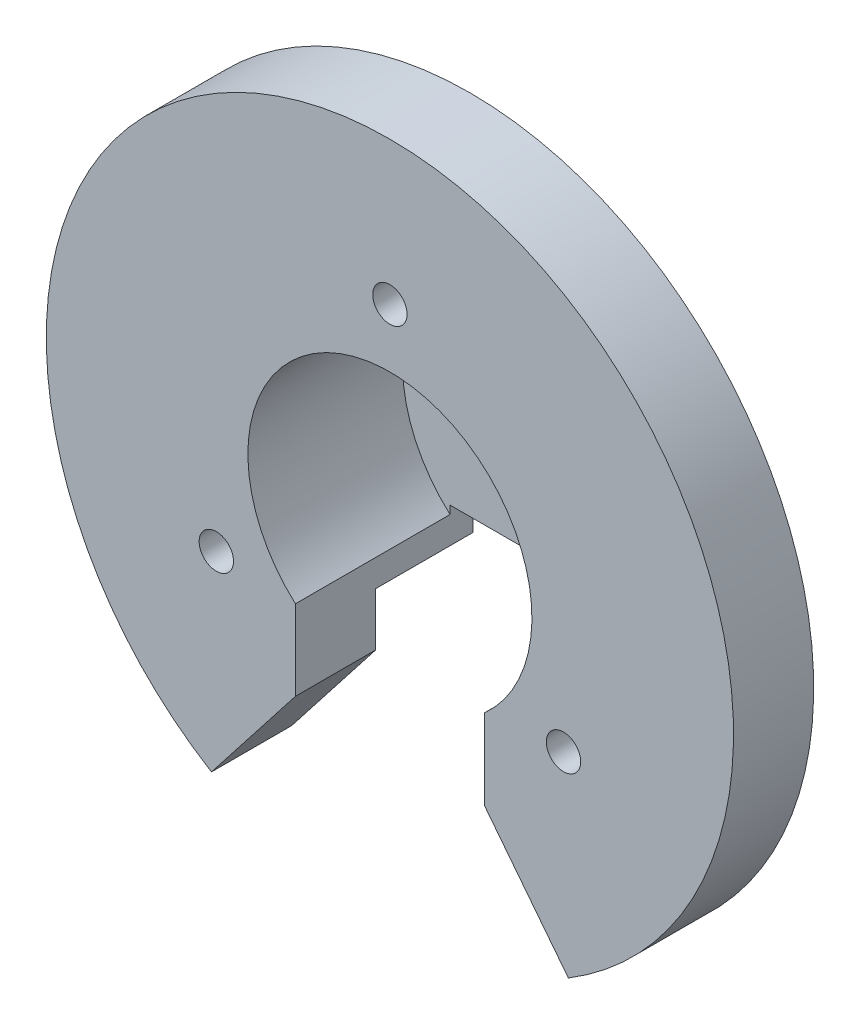
from build123d import *

# Parameters (mm, degrees)
SKETCH_1_R               = 14.25
SKETCH_1_R_2             = 12.4
EXTRUDE_1_DEPTH          = 13.5
EXTRUDE_START            = 2
SKETCH_2_R               = 14.25
SKETCH_2_R_2             = 4.5
SKETCH_2_R_3             = 1.5
EXTRUDE_2_DEPTH          = 2
EXTRUDE_START_2          = -2
SKETCH_5_R               = 30
SKETCH_5_R_2             = 12.4
EXTRUDE_3_DEPTH          = 2
CUT_EXTRUDE_2_DEPTH      = 2
CUT_EXTRUDE_2_DEPTH_BACK = 19
SKETCH_6_R               = 1.5
CUT_EXTRUDE_3_DEPTH      = 2
SKETCH_8_R               = 1.5
EXTRUDE_4_DEPTH          = 5


with BuildPart() as part:
    # 草图1 → 凸台-拉伸1 (new body)
    with BuildSketch(Plane.XY):
        Circle(SKETCH_1_R)
        Circle(SKETCH_1_R_2, mode=Mode.SUBTRACT)
    extrude(amount=EXTRUDE_1_DEPTH)

    # 草图2 → 凸台-拉伸2 (add)
    with BuildSketch(Plane(origin=(0, 0, 0), x_dir=(-1, 0, 0), z_dir=(0, 0, -1)).offset(EXTRUDE_START)):
        Circle(SKETCH_2_R)
        Circle(SKETCH_2_R_2, mode=Mode.SUBTRACT)
        with Locations((-10, 0)):
            Circle(SKETCH_2_R_3, mode=Mode.SUBTRACT)
    extrude(amount=-EXTRUDE_2_DEPTH)

    # 草图5 → 凸台-拉伸3 (add)
    with BuildSketch(Plane.XY.offset(13.5).offset(EXTRUDE_START_2)):
        Circle(SKETCH_5_R)
        Circle(SKETCH_5_R_2, mode=Mode.SUBTRACT)
    extrude(amount=EXTRUDE_3_DEPTH)

    # 草图4 → 切除-拉伸2 (cut, two sides: drawn at the far end of the back side and taken through both)
    with BuildSketch(Plane.XY.offset(13.5).offset(-CUT_EXTRUDE_2_DEPTH_BACK)):
        Polygon((-8.25, -16.255900921), (-15.579618383, -25.637384637), (-4.242821572, -33.778563125), (18.383281344, -29.225909584), (8.25, -16.255900921), (8.25, -8.544099079), (-8.25, -8.544099079), align=None)
    extrude(amount=CUT_EXTRUDE_2_DEPTH + CUT_EXTRUDE_2_DEPTH_BACK, mode=Mode.SUBTRACT)

    # 草图6 → 切除-拉伸3 (cut)
    with BuildSketch(Plane.XY.offset(13.5)):
        with Locations((0, 17.5)):
            Circle(SKETCH_6_R)
        with Locations((15.155444566, -8.75)):
            Circle(SKETCH_6_R)
        with Locations((-15.155444566, -8.75)):
            Circle(SKETCH_6_R)
    extrude(amount=-CUT_EXTRUDE_3_DEPTH, mode=Mode.SUBTRACT)

    # 草图8 → 凸台-拉伸4 (add)
    with BuildSketch(Plane(origin=(0, 0, 11.5), x_dir=(-1, 0, 0), z_dir=(0, 0, -1))):
        with BuildLine():
            Line((8.25, -11.618950039), (8.25, -16.255900921))
            Line((8.25, -16.255900921), (15.579618383, -25.637384637))
            ThreePointArc((15.579618383, -25.637384637), (0, 30), (-15.579618383, -25.637384637))
            Line((-15.579618383, -25.637384637), (-8.25, -16.255900921))
            Line((-8.25, -16.255900921), (-8.25, -11.618950039))
            ThreePointArc((-8.25, -11.618950039), (0, 14.25), (8.25, -11.618950039))
        make_face()
        with Locations(Location((0, 17.5, 0), (0, 0, 180))):
            Circle(SKETCH_8_R, mode=Mode.SUBTRACT)
        with Locations(Location((-15.155444566, -8.75, 0), (0, 0, 180))):
            Circle(SKETCH_8_R, mode=Mode.SUBTRACT)
        with Locations(Location((15.155444566, -8.75, 0), (0, 0, 180))):
            Circle(SKETCH_8_R, mode=Mode.SUBTRACT)
    extrude(amount=EXTRUDE_4_DEPTH)


solid = part.part
